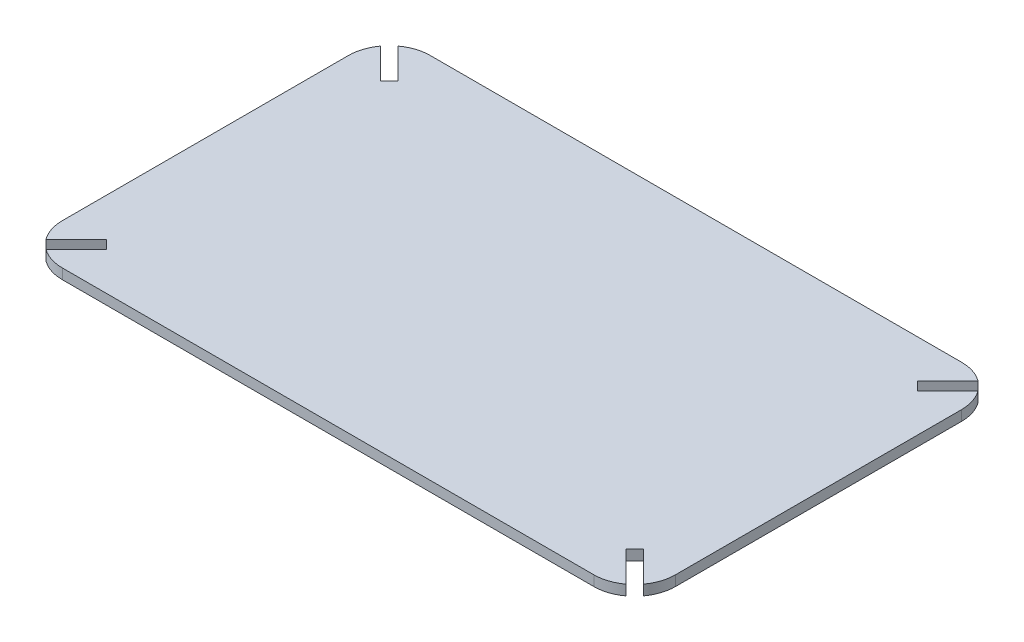
from build123d import *

# Parameters (mm, degrees)
BASE_SUPPORT_DEPTH = 6.35
CUT_EXTRUDE1_DEPTH = 6.35


with BuildPart() as part:
    # Sketch1 → Base Support (new body)
    with BuildSketch(Plane(origin=(0, 0, 0), x_dir=(1, 0, 0), z_dir=(0, 1, 0))):
        with BuildLine():
            Line((-165.1, -114.3), (165.1, -114.3))
            ThreePointArc((165.1, -114.3), (183.060512242, -106.860512242), (190.5, -88.9))
            Line((190.5, -88.9), (190.5, 88.9))
            ThreePointArc((190.5, 88.9), (183.060512242, 106.860512242), (165.1, 114.3))
            Line((165.1, 114.3), (-165.1, 114.3))
            ThreePointArc((-165.1, 114.3), (-183.060512242, 106.860512242), (-190.5, 88.9))
            Line((-190.5, 88.9), (-190.5, -88.9))
            ThreePointArc((-190.5, -88.9), (-183.060512242, -106.860512242), (-165.1, -114.3))
        make_face()
    extrude(amount=BASE_SUPPORT_DEPTH)

    # Sketch2 → Cut-Extrude1 (cut)
    with BuildSketch(Plane(origin=(0, 0, 0), x_dir=(1, 0, 0), z_dir=(0, 1, 0))):
        with BuildLine():
            Line((-180.16323011, -109.351383783), (-161.304692256, -90.492845929))
            Line((-161.304692256, -90.492845929), (-166.692845929, -85.104692256))
            Line((-166.692845929, -85.104692256), (-185.551383783, -103.96323011))
            ThreePointArc((-185.551383783, -103.96323011), (-183.060512242, -106.860512242), (-180.16323011, -109.351383783))
        make_face()
        with BuildLine():
            Line((161.304692256, -90.492845929), (166.692845929, -85.104692256))
            Line((166.692845929, -85.104692256), (185.551383783, -103.96323011))
            ThreePointArc((185.551383783, -103.96323011), (183.060512242, -106.860512242), (180.16323011, -109.351383783))
            Line((180.16323011, -109.351383783), (161.304692256, -90.492845929))
        make_face()
        with BuildLine():
            Line((180.16323011, 109.351383783), (161.304692256, 90.492845929))
            Line((161.304692256, 90.492845929), (166.692845929, 85.104692256))
            Line((166.692845929, 85.104692256), (185.551383783, 103.96323011))
            ThreePointArc((185.551383783, 103.96323011), (183.060512242, 106.860512242), (180.16323011, 109.351383783))
        make_face()
        with BuildLine():
            Line((-166.692845929, 85.104692256), (-185.551383783, 103.96323011))
            ThreePointArc((-185.551383783, 103.96323011), (-183.060512242, 106.860512242), (-180.16323011, 109.351383783))
            Line((-180.16323011, 109.351383783), (-161.304692256, 90.492845929))
            Line((-161.304692256, 90.492845929), (-166.692845929, 85.104692256))
        make_face()
    extrude(amount=CUT_EXTRUDE1_DEPTH, mode=Mode.SUBTRACT)


solid = part.part
